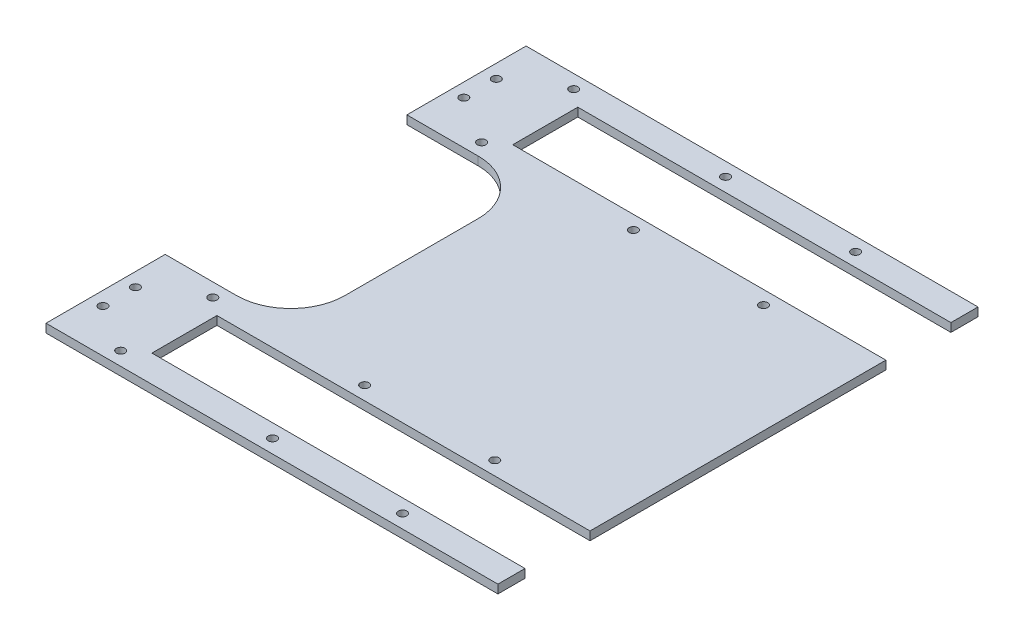
from build123d import *

# Parameters (mm, degrees)
BOSS_EXTRUDE1_DEPTH     = 2
FILLET1_R               = 12.7
CUT_EXTRUDE1_DEPTH      = 85.94357346
CUT_EXTRUDE1_DEPTH_BACK = 85.94357346
SKETCH2_R               = 1.00000054
CUT_EXTRUDE2_DEPTH      = 85.94357346
CUT_EXTRUDE2_DEPTH_BACK = 85.94357346
SKETCH3_W               = 3.81
SKETCH3_H               = 22.86
CUT_EXTRUDE3_DEPTH      = 85.94357346
CUT_EXTRUDE4_DEPTH      = 85.94357346
SKETCH7_R               = 1.00000054
SKETCH7_W               = 1.965807504
SKETCH7_H               = 35.56
CUT_EXTRUDE5_DEPTH      = 85.94357346
SKETCH9_R               = 1.00000054
SKETCH9_W               = 5.08
SKETCH9_H               = 35.56
CUT_EXTRUDE6_DEPTH      = 85.94357346
SKETCH10_W              = 3.261861975
SKETCH10_H              = 39.805650988
SKETCH10_W_2            = 3.49604191
SKETCH10_H_2            = 37.586377376
BOSS_EXTRUDE2_DEPTH     = 2
SKETCH11_W              = 18.472083706
SKETCH11_H              = 7.62
CUT_EXTRUDE7_DEPTH      = 85.349523446
CUT_EXTRUDE8_DEPTH      = 85.349523446
SKETCH13_R              = 1.00000054
BOSS_EXTRUDE3_DEPTH     = 2
CUT_EXTRUDE9_DEPTH      = 85.349523446
SKETCH15_R              = 1.00000054
BOSS_EXTRUDE6_DEPTH     = 2
SKETCH16_W              = 4.512091431
SKETCH16_H              = 18.148634424
SKETCH16_W_2            = 6.251984605
SKETCH16_H_2            = 13.072331447
BOSS_EXTRUDE7_DEPTH     = 2
SKETCH17_R              = 1.00000054
CUT_EXTRUDE10_DEPTH     = 79.736015048
SKETCH18_W              = 71.149585785
SKETCH18_H              = 51.177772232
BOSS_EXTRUDE8_DEPTH     = 2


with BuildPart() as part:
    # Sketch1 → Boss-Extrude1 (new body)
    with BuildSketch(Plane(origin=(0, 0, 0), x_dir=(1, 0, 0), z_dir=(0, 1, 0))):
        Polygon((-55.952019723, 28.533921393), (-55.951080052, 28.321), (-21.455288819, 28.321), (-21.455288819, -28.321), (-55.952019723, -28.321), (-55.952019723, -63.881), (55.045980277, -63.881), (55.045980277, -57.531), (32.458455221, -57.531), (-28.589936017, -57.531), (-28.589936017, -46.101), (-28.589936017, -34.671), (32.458455221, -34.671), (55.045980277, -34.671), (55.045980277, 34.671), (32.458455221, 34.671), (-28.589936017, 34.671), (-28.589936017, 46.101), (-28.589936017, 57.531), (32.458455221, 57.531), (55.045980277, 57.531), (55.045980277, 63.881), (-55.952019723, 63.881), align=None)
    extrude(amount=BOSS_EXTRUDE1_DEPTH)

    # Fillet1
    fillet1_edges = [part.edges().sort_by_distance(p)[0] for p in [
        (-21.455288819, 1, 28.321),
        (-21.455288819, 1, -28.321),
    ]]
    fillet(fillet1_edges, radius=FILLET1_R)

    # Sketch2 → Cut-Extrude1 (cut, two sides: drawn at the far end of the back side and taken through both)
    with BuildSketch(Plane(origin=(0, 2, 0), x_dir=(1, 0, 0), z_dir=(0, 1, 0)).offset(-CUT_EXTRUDE1_DEPTH_BACK)):
        with Locations(Location((51.870980277, 0, 0), (0, 0, 270))):
            Circle(SKETCH2_R)
        with Locations(Location((51.870980277, 14.1605, 0), (0, 0, 270))):
            Circle(SKETCH2_R)
        with Locations(Location((-18.280288819, 0, 0), (0, 0, 270))):
            Circle(SKETCH2_R)
        with Locations(Location((-18.280288819, -14.1605, 0), (0, 0, 270))):
            Circle(SKETCH2_R)
        with Locations(Location((-18.280288819, 14.1605, 0), (0, 0, 270))):
            Circle(SKETCH2_R)
        with Locations(Location((-36.538995414, 31.496, 0), (0, 0, 270))):
            Circle(SKETCH2_R)
        with Locations(Location((-0.948104424, 31.496, 0), (0, 0, 270))):
            Circle(SKETCH2_R)
        with Locations(Location((29.531895576, 31.488302757, 0), (0, 0, 270))):
            Circle(SKETCH2_R)
        with Locations(Location((-52.777019723, 45.1485, 0), (0, 0, 270))):
            Circle(SKETCH2_R)
        with Locations(Location((-52.777019723, 53.4035, 0), (0, 0, 270))):
            Circle(SKETCH2_R)
        with Locations(Location((-36.538995414, 60.706, 0), (0, 0, 270))):
            Circle(SKETCH2_R)
        with Locations(Location((-0.948104424, 60.706, 0), (0, 0, 270))):
            Circle(SKETCH2_R)
        with Locations(Location((29.531895576, 60.713697243, 0), (0, 0, 270))):
            Circle(SKETCH2_R)
        with Locations(Location((29.531895576, -60.713697243, 0), (0, 0, 270))):
            Circle(SKETCH2_R)
        with Locations(Location((-0.948104424, -60.706, 0), (0, 0, 270))):
            Circle(SKETCH2_R)
        with Locations(Location((-36.538995414, -60.706, 0), (0, 0, 270))):
            Circle(SKETCH2_R)
        with Locations(Location((-52.777019723, -53.4035, 0), (0, 0, 270))):
            Circle(SKETCH2_R)
        with Locations(Location((-52.777019723, -45.1485, 0), (0, 0, 270))):
            Circle(SKETCH2_R)
        with Locations(Location((29.531895576, -31.488302757, 0), (0, 0, 270))):
            Circle(SKETCH2_R)
        with Locations(Location((-0.948104424, -31.496, 0), (0, 0, 270))):
            Circle(SKETCH2_R)
        with Locations(Location((-36.538995414, -31.496, 0), (0, 0, 270))):
            Circle(SKETCH2_R)
        with Locations(Location((51.870980277, -14.1605, 0), (0, 0, 270))):
            Circle(SKETCH2_R)
    extrude(amount=CUT_EXTRUDE1_DEPTH + CUT_EXTRUDE1_DEPTH_BACK, mode=Mode.SUBTRACT)

    # Sketch3 → Cut-Extrude2 (cut, two sides: drawn at the far end of the back side and taken through both)
    with BuildSketch(Plane(origin=(0, 2, 0), x_dir=(1, 0, 0), z_dir=(0, 1, 0)).offset(-CUT_EXTRUDE2_DEPTH_BACK)):
        with Locations((-30.494936017, -46.101)):
            Rectangle(SKETCH3_W, SKETCH3_H)
        with Locations((-30.494936017, 46.101)):
            Rectangle(SKETCH3_W, SKETCH3_H)
    extrude(amount=CUT_EXTRUDE2_DEPTH + CUT_EXTRUDE2_DEPTH_BACK, mode=Mode.SUBTRACT)

    # Sketch5 → Cut-Extrude3 (cut, through all)
    with BuildSketch(Plane(origin=(0, 2, 0), x_dir=(1, 0, 0), z_dir=(0, 1, 0))):
        with BuildLine():
            Line((-7.280288819, 22.171), (-7.280288819, 6.25))
            ThreePointArc((-7.280288819, 6.25), (-8.280288819, 5.25), (-9.280288819, 6.25))
            Line((-9.280288819, 6.25), (-9.280288819, 22.171))
            ThreePointArc((-9.280288819, 22.171), (-8.280288819, 23.171), (-7.280288819, 22.171))
        make_face()
        with BuildLine():
            Line((-7.280288819, -22.171), (-7.280288819, -6.25))
            ThreePointArc((-7.280288819, -6.25), (-8.280288819, -5.25), (-9.280288819, -6.25))
            Line((-9.280288819, -6.25), (-9.280288819, -22.171))
            ThreePointArc((-9.280288819, -22.171), (-8.280288819, -23.171), (-7.280288819, -22.171))
        make_face()
        with BuildLine():
            Line((-4.280288819, 22.171), (-4.280288819, 6.25))
            ThreePointArc((-4.280288819, 6.25), (-3.280288819, 5.25), (-2.280288819, 6.25))
            Line((-2.280288819, 6.25), (-2.280288819, 22.171))
            ThreePointArc((-2.280288819, 22.171), (-3.280288819, 23.171), (-4.280288819, 22.171))
        make_face()
        with BuildLine():
            Line((2.719711181, 22.171), (2.719711181, 6.25))
            ThreePointArc((2.719711181, 6.25), (1.719711181, 5.25), (0.719711181, 6.25))
            Line((0.719711181, 6.25), (0.719711181, 22.171))
            ThreePointArc((0.719711181, 22.171), (1.719711181, 23.171), (2.719711181, 22.171))
        make_face()
        with BuildLine():
            Line((2.719711181, -22.171), (2.719711181, -6.25))
            ThreePointArc((2.719711181, -6.25), (1.719711181, -5.25), (0.719711181, -6.25))
            Line((0.719711181, -6.25), (0.719711181, -22.171))
            ThreePointArc((0.719711181, -22.171), (1.719711181, -23.171), (2.719711181, -22.171))
        make_face()
        with BuildLine():
            Line((-4.280288819, -22.171), (-4.280288819, -6.25))
            ThreePointArc((-4.280288819, -6.25), (-3.280288819, -5.25), (-2.280288819, -6.25))
            Line((-2.280288819, -6.25), (-2.280288819, -22.171))
            ThreePointArc((-2.280288819, -22.171), (-3.280288819, -23.171), (-4.280288819, -22.171))
        make_face()
    extrude(amount=-CUT_EXTRUDE3_DEPTH, mode=Mode.SUBTRACT)

    # Sketch6 → Cut-Extrude4 (cut, through all)
    with BuildSketch(Plane(origin=(0, 2, 0), x_dir=(1, 0, 0), z_dir=(0, 1, 0))):
        with BuildLine():
            Line((23.282365986, 8.144284406), (12.061731324, 4.060307379))
            ThreePointArc((12.061731324, 4.060307379), (10.78001856, 4.657979857), (11.377691038, 5.939692621))
            Line((11.377691038, 5.939692621), (22.598325699, 10.023669647))
            ThreePointArc((22.598325699, 10.023669647), (23.880038464, 9.42599717), (23.282365986, 8.144284406))
        make_face()
        with BuildLine():
            Line((35.782365986, 8.144284406), (24.561731324, 4.060307379))
            ThreePointArc((24.561731324, 4.060307379), (23.28001856, 4.657979857), (23.877691038, 5.939692621))
            Line((23.877691038, 5.939692621), (35.098325699, 10.023669647))
            ThreePointArc((35.098325699, 10.023669647), (36.380038464, 9.42599717), (35.782365986, 8.144284406))
        make_face()
        with BuildLine():
            Line((48.282365986, 8.144284406), (37.061731324, 4.060307379))
            ThreePointArc((37.061731324, 4.060307379), (35.78001856, 4.657979857), (36.377691038, 5.939692621))
            Line((36.377691038, 5.939692621), (47.598325699, 10.023669647))
            ThreePointArc((47.598325699, 10.023669647), (48.880038464, 9.42599717), (48.282365986, 8.144284406))
        make_face()
        with BuildLine():
            Line((23.212938712, 16.811828882), (11.992304051, 12.727851856))
            ThreePointArc((11.992304051, 12.727851856), (10.710591286, 13.325524333), (11.308263764, 14.607237098))
            Line((11.308263764, 14.607237098), (22.528898426, 18.691214124))
            ThreePointArc((22.528898426, 18.691214124), (23.81061119, 18.093541647), (23.212938712, 16.811828882))
        make_face()
        with BuildLine():
            Line((35.712938712, 16.811828882), (24.492304051, 12.727851856))
            ThreePointArc((24.492304051, 12.727851856), (23.210591286, 13.325524333), (23.808263764, 14.607237098))
            Line((23.808263764, 14.607237098), (35.028898426, 18.691214124))
            ThreePointArc((35.028898426, 18.691214124), (36.31061119, 18.093541647), (35.712938712, 16.811828882))
        make_face()
        with BuildLine():
            Line((48.212938712, 16.811828882), (36.992304051, 12.727851856))
            ThreePointArc((36.992304051, 12.727851856), (35.710591286, 13.325524333), (36.308263764, 14.607237098))
            Line((36.308263764, 14.607237098), (47.528898426, 18.691214124))
            ThreePointArc((47.528898426, 18.691214124), (48.81061119, 18.093541647), (48.212938712, 16.811828882))
        make_face()
        with BuildLine():
            Line((48.282365986, -8.144284406), (37.061731324, -4.060307379))
            ThreePointArc((37.061731324, -4.060307379), (35.78001856, -4.657979857), (36.377691038, -5.939692621))
            Line((36.377691038, -5.939692621), (47.598325699, -10.023669647))
            ThreePointArc((47.598325699, -10.023669647), (48.880038464, -9.42599717), (48.282365986, -8.144284406))
        make_face()
        with BuildLine():
            Line((35.782365986, -8.144284406), (24.561731324, -4.060307379))
            ThreePointArc((24.561731324, -4.060307379), (23.28001856, -4.657979857), (23.877691038, -5.939692621))
            Line((23.877691038, -5.939692621), (35.098325699, -10.023669647))
            ThreePointArc((35.098325699, -10.023669647), (36.380038464, -9.42599717), (35.782365986, -8.144284406))
        make_face()
        with BuildLine():
            Line((23.282365986, -8.144284406), (12.061731324, -4.060307379))
            ThreePointArc((12.061731324, -4.060307379), (10.78001856, -4.657979857), (11.377691038, -5.939692621))
            Line((11.377691038, -5.939692621), (22.598325699, -10.023669647))
            ThreePointArc((22.598325699, -10.023669647), (23.880038464, -9.42599717), (23.282365986, -8.144284406))
        make_face()
        with BuildLine():
            Line((48.212938712, -16.811828882), (36.992304051, -12.727851856))
            ThreePointArc((36.992304051, -12.727851856), (35.710591286, -13.325524333), (36.308263764, -14.607237098))
            Line((36.308263764, -14.607237098), (47.528898426, -18.691214124))
            ThreePointArc((47.528898426, -18.691214124), (48.81061119, -18.093541647), (48.212938712, -16.811828882))
        make_face()
        with BuildLine():
            Line((35.712938712, -16.811828882), (24.492304051, -12.727851856))
            ThreePointArc((24.492304051, -12.727851856), (23.210591286, -13.325524333), (23.808263764, -14.607237098))
            Line((23.808263764, -14.607237098), (35.028898426, -18.691214124))
            ThreePointArc((35.028898426, -18.691214124), (36.31061119, -18.093541647), (35.712938712, -16.811828882))
        make_face()
        with BuildLine():
            Line((23.212938712, -16.811828882), (11.992304051, -12.727851856))
            ThreePointArc((11.992304051, -12.727851856), (10.710591286, -13.325524333), (11.308263764, -14.607237098))
            Line((11.308263764, -14.607237098), (22.528898426, -18.691214124))
            ThreePointArc((22.528898426, -18.691214124), (23.81061119, -18.093541647), (23.212938712, -16.811828882))
        make_face()
    extrude(amount=-CUT_EXTRUDE4_DEPTH, mode=Mode.SUBTRACT)

    # Sketch7 → Cut-Extrude5 (cut, through all)
    with BuildSketch(Plane.XZ):
        with Locations((-54.742827227, 53.4035)):
            Circle(SKETCH7_R)
        with Locations((-54.742827227, 45.1485)):
            Circle(SKETCH7_R)
        with Locations((-54.742827227, -45.1485)):
            Circle(SKETCH7_R)
        with Locations((-54.742827227, -53.4035)):
            Circle(SKETCH7_R)
        with Locations((-56.934923475, 46.101)):
            Rectangle(SKETCH7_W, SKETCH7_H)
        with Locations((-56.934923475, -46.101)):
            Rectangle(SKETCH7_W, SKETCH7_H)
    extrude(amount=-CUT_EXTRUDE5_DEPTH, mode=Mode.SUBTRACT)

    # Sketch9 → Cut-Extrude6 (cut, through all)
    with BuildSketch(Plane.XZ):
        with Locations(Location((-47.697019723, 53.4035, 0), (0, 0, 270))):
            Circle(SKETCH9_R)
        with Locations(Location((-47.697019723, 45.1485, 0), (0, 0, 270))):
            Circle(SKETCH9_R)
        with Locations(Location((-47.697019723, -45.1485, 0), (0, 0, 90))):
            Circle(SKETCH9_R)
        with Locations(Location((-47.697019723, -53.4035, 0), (0, 0, 90))):
            Circle(SKETCH9_R)
        with Locations((-53.412019723, 46.101)):
            Rectangle(SKETCH9_W, SKETCH9_H)
        with Locations((-53.412019723, -46.101)):
            Rectangle(SKETCH9_W, SKETCH9_H)
    extrude(amount=-CUT_EXTRUDE6_DEPTH, mode=Mode.SUBTRACT)

    # Sketch10 → Boss-Extrude2 (add)
    with BuildSketch(Plane(origin=(0, 2, 0), x_dir=(1, 0, 0), z_dir=(0, 1, 0))):
        with Locations((-18.280288819, 0)):
            Rectangle(SKETCH10_W, SKETCH10_H)
        with Locations((51.870980277, 0)):
            Rectangle(SKETCH10_W_2, SKETCH10_H_2)
    extrude(amount=-BOSS_EXTRUDE2_DEPTH)

    # Sketch11 → Cut-Extrude7 (cut, through all)
    with BuildSketch(Plane(origin=(0, 2, 0), x_dir=(1, 0, 0), z_dir=(0, 1, 0))):
        with Locations((-41.63597787, -38.481)):
            Rectangle(SKETCH11_W, SKETCH11_H)
    extrude(amount=-CUT_EXTRUDE7_DEPTH, mode=Mode.SUBTRACT)


with BuildPart() as cut_extrude7_piece_1:
    # of the separate pieces the step leaves, piece 1, a body of its own (cut_extrude7_pieces)
    add(part.part.solids().sort_by_distance((-50.872019723, 2, -28.321))[0])

    # Sketch12 → Cut-Extrude8 (cut, through all)
    with BuildSketch(Plane(origin=(0, 2, 0), x_dir=(1, 0, 0), z_dir=(0, 1, 0))):
        Polygon((-32.399936017, 34.671), (-69.840957795, 34.671), (-69.840957795, 70.713964433), (61.672853026, 70.713964433), (61.672853026, 34.671), align=None)
    extrude(amount=-CUT_EXTRUDE8_DEPTH, mode=Mode.SUBTRACT)

    # Sketch13 → Boss-Extrude3 (add)
    with BuildSketch(Plane(origin=(0, 2, 0), x_dir=(1, 0, 0), z_dir=(0, 1, 0))):
        Polygon((55.045980277, 49.911), (-32.399936017, 49.911), (-32.399936017, 34.671), (-50.872019723, 34.671), (-50.872019723, 56.261), (55.045980277, 56.261), align=None)
        with Locations(Location((29.531895576, 53.093697243, 0), (0, 0, 270))):
            Circle(SKETCH13_R, mode=Mode.SUBTRACT)
        with Locations(Location((-0.948104424, 53.086, 0), (0, 0, 270))):
            Circle(SKETCH13_R, mode=Mode.SUBTRACT)
        with Locations(Location((-36.538995414, 53.086, 0), (0, 0, 270))):
            Circle(SKETCH13_R, mode=Mode.SUBTRACT)
        with Locations(Location((-47.697019723, 45.7835, 0), (0, 0, 270))):
            Circle(SKETCH13_R, mode=Mode.SUBTRACT)
        with Locations(Location((-47.697019723, 37.5285, 0), (0, 0, 270))):
            Circle(SKETCH13_R, mode=Mode.SUBTRACT)
    extrude(amount=-BOSS_EXTRUDE3_DEPTH)

    # Sketch15 → Boss-Extrude6 (add)
    with BuildSketch(Plane(origin=(0, 2, 0), x_dir=(1, 0, 0), z_dir=(0, 1, 0))):
        Polygon((-50.872019723, -34.671), (-50.872019723, -56.261), (55.045980277, -56.261), (55.045980277, -49.911), (-32.399936017, -49.911), (-32.399936017, -34.671), align=None)
        with Locations(Location((-47.697019723, -45.7835, 0), (0, 0, 270))):
            Circle(SKETCH15_R, mode=Mode.SUBTRACT)
        with Locations(Location((-47.697019723, -37.5285, 0), (0, 0, 270))):
            Circle(SKETCH15_R, mode=Mode.SUBTRACT)
        with Locations(Location((-36.538995414, -53.086, 0), (0, 0, 270))):
            Circle(SKETCH15_R, mode=Mode.SUBTRACT)
        with Locations(Location((-0.948104424, -53.086, 0), (0, 0, 270))):
            Circle(SKETCH15_R, mode=Mode.SUBTRACT)
        with Locations(Location((29.531895576, -53.093697243, 0), (0, 0, 270))):
            Circle(SKETCH15_R, mode=Mode.SUBTRACT)
    extrude(amount=-BOSS_EXTRUDE6_DEPTH)

    # Sketch16 → Boss-Extrude7 (add)
    with BuildSketch(Plane.XZ):
        with Locations((-48.131896009, -42.111008016)):
            Rectangle(SKETCH16_W, SKETCH16_H)
        with Locations((-47.11527877, 41.979427187)):
            Rectangle(SKETCH16_W_2, SKETCH16_H_2)
    extrude(amount=-BOSS_EXTRUDE7_DEPTH)

    # Sketch17 → Cut-Extrude10 (cut, through all)
    with BuildSketch(Plane(origin=(0, 2, 0), x_dir=(1, 0, 0), z_dir=(0, 1, 0))):
        with Locations(Location((-47.697019723, -38.481, 0), (0, 0, 270))):
            Circle(SKETCH17_R)
        with Locations(Location((-47.697019723, -46.101, 0), (0, 0, 90))):
            Circle(SKETCH17_R)
        with Locations(Location((-47.697019723, 38.481, 0), (0, 0, 90))):
            Circle(SKETCH17_R)
        with Locations(Location((-47.697019723, 46.101, 0), (0, 0, 270))):
            Circle(SKETCH17_R)
    extrude(amount=-CUT_EXTRUDE10_DEPTH, mode=Mode.SUBTRACT)

    # Sketch18 → Boss-Extrude8 (add)
    with BuildSketch(Plane.XZ):
        with Locations((15.639282332, 0)):
            Rectangle(SKETCH18_W, SKETCH18_H)
    extrude(amount=-BOSS_EXTRUDE8_DEPTH)


with BuildPart() as cut_extrude7_piece_2:
    # of the separate pieces the step leaves, piece 2, a body of its own (cut_extrude7_pieces)
    add(part.part.solids().sort_by_distance((-32.399936017, 2, 42.291))[0])

    # Sketch14 → Cut-Extrude9 (cut, through all)
    with BuildSketch(Plane(origin=(0, 2, 0), x_dir=(1, 0, 0), z_dir=(0, 1, 0))):
        Polygon((-32.399936017, -42.291), (-50.872019723, -42.291), (-50.872019723, -63.881), (55.045980277, -63.881), (55.045980277, -57.531), (-32.399936017, -57.531), align=None)
    extrude(amount=-CUT_EXTRUDE9_DEPTH, mode=Mode.SUBTRACT)


solid = cut_extrude7_piece_1.part
